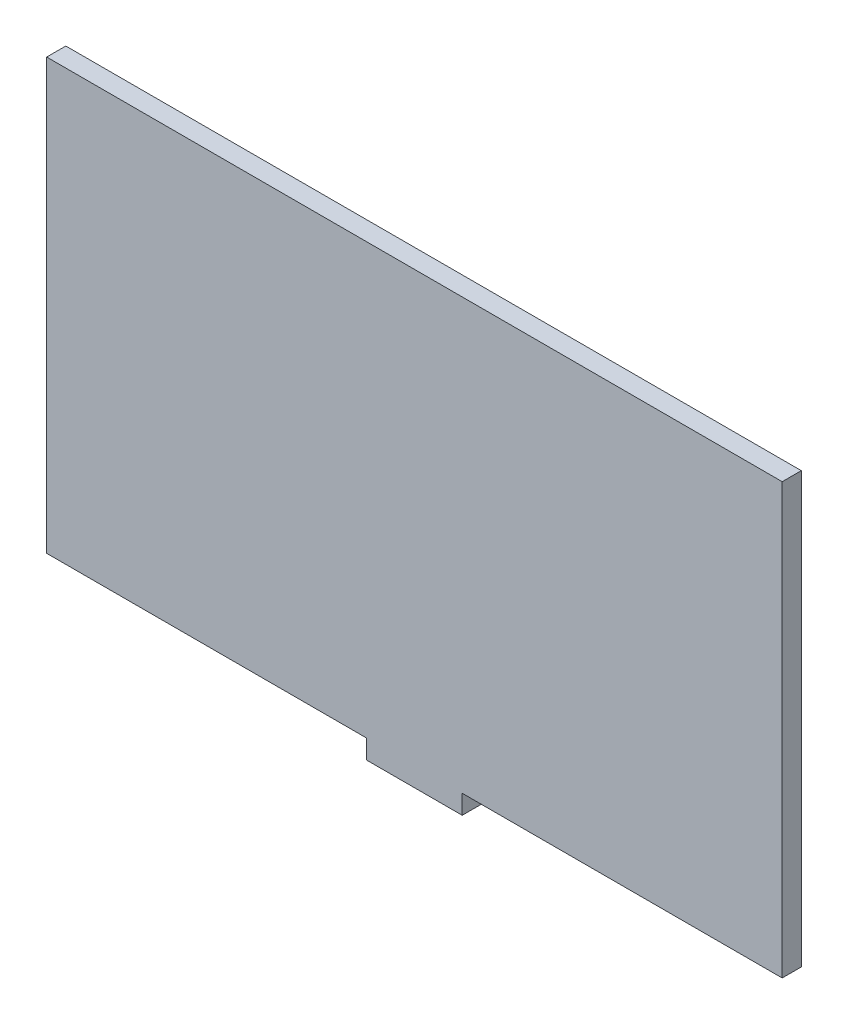
from build123d import *

# Parameters (mm, degrees)
EXTRUDE_1_DEPTH = 2


with BuildPart() as part:
    # 草图2 → 凸台-拉伸1 (new body)
    with BuildSketch(Plane.XY):
        Polygon((9.446519886, -32.698693295), (42.946519886, -32.698693295), (42.946519886, 12.301306705), (-34.053480114, 12.301306705), (-34.053480114, -32.698693295), (-0.553480114, -32.698693295), (-0.553480114, -34.698693295), (9.446519886, -34.698693295), align=None)
    extrude(amount=EXTRUDE_1_DEPTH)


solid = part.part
